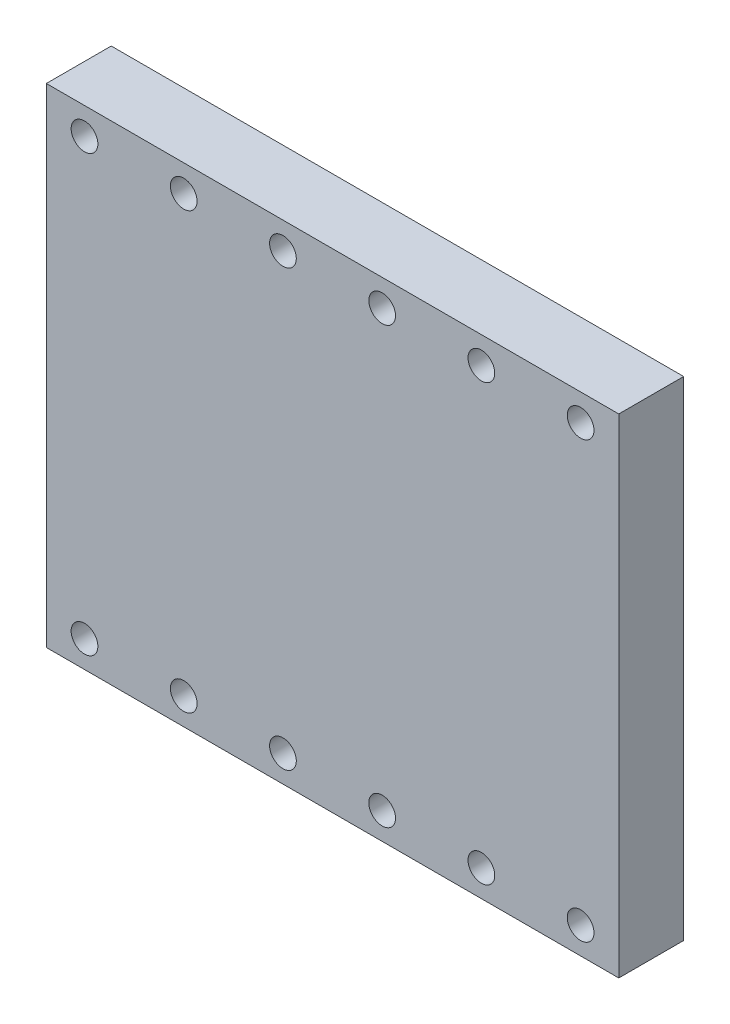
from build123d import *

# Parameters (mm, degrees)
SKETCH1_W           = 15
SKETCH1_H           = 12.8
BOSS_EXTRUDE1_DEPTH = 1.7
SKETCH1_3_W         = 2
SKETCH1_3_H         = 1.2
BOSS_EXTRUDE2_DEPTH = 0.5
SKETCH1_4_R         = 0.35
CUT_EXTRUDE1_DEPTH  = 11.004998751


with BuildPart() as part:
    # Sketch1 → Boss-Extrude1 (new body)
    with BuildSketch(Plane.XY):
        Rectangle(SKETCH1_W, SKETCH1_H)
    extrude(amount=BOSS_EXTRUDE1_DEPTH)

    # Sketch1<3> → Boss-Extrude2 (add)
    with BuildSketch(Plane.XY):
        with Locations((-2, 0)):
            Rectangle(SKETCH1_3_W, SKETCH1_3_H)
        with Locations((-6, 0)):
            Rectangle(SKETCH1_3_W, SKETCH1_3_H)
        with Locations((2, 0)):
            Rectangle(SKETCH1_3_W, SKETCH1_3_H)
        with Locations((6, 0)):
            Rectangle(SKETCH1_3_W, SKETCH1_3_H)
    extrude(amount=-BOSS_EXTRUDE2_DEPTH)

    # Sketch1<4> → Cut-Extrude1 (cut, through all)
    with BuildSketch(Plane.XY):
        with Locations((-6.5, 5.7)):
            Circle(SKETCH1_4_R)
        with Locations((-3.9, 5.7)):
            Circle(SKETCH1_4_R)
        with Locations((-1.3, 5.7)):
            Circle(SKETCH1_4_R)
        with Locations((1.3, 5.7)):
            Circle(SKETCH1_4_R)
        with Locations((3.9, 5.7)):
            Circle(SKETCH1_4_R)
        with Locations((6.5, 5.7)):
            Circle(SKETCH1_4_R)
        with Locations((-1.3, -5.7)):
            Circle(SKETCH1_4_R)
        with Locations((6.5, -5.7)):
            Circle(SKETCH1_4_R)
        with Locations((3.9, -5.7)):
            Circle(SKETCH1_4_R)
        with Locations((1.3, -5.7)):
            Circle(SKETCH1_4_R)
        with Locations((-3.9, -5.7)):
            Circle(SKETCH1_4_R)
        with Locations((-6.5, -5.7)):
            Circle(SKETCH1_4_R)
    extrude(amount=CUT_EXTRUDE1_DEPTH, mode=Mode.SUBTRACT)


solid = part.part
